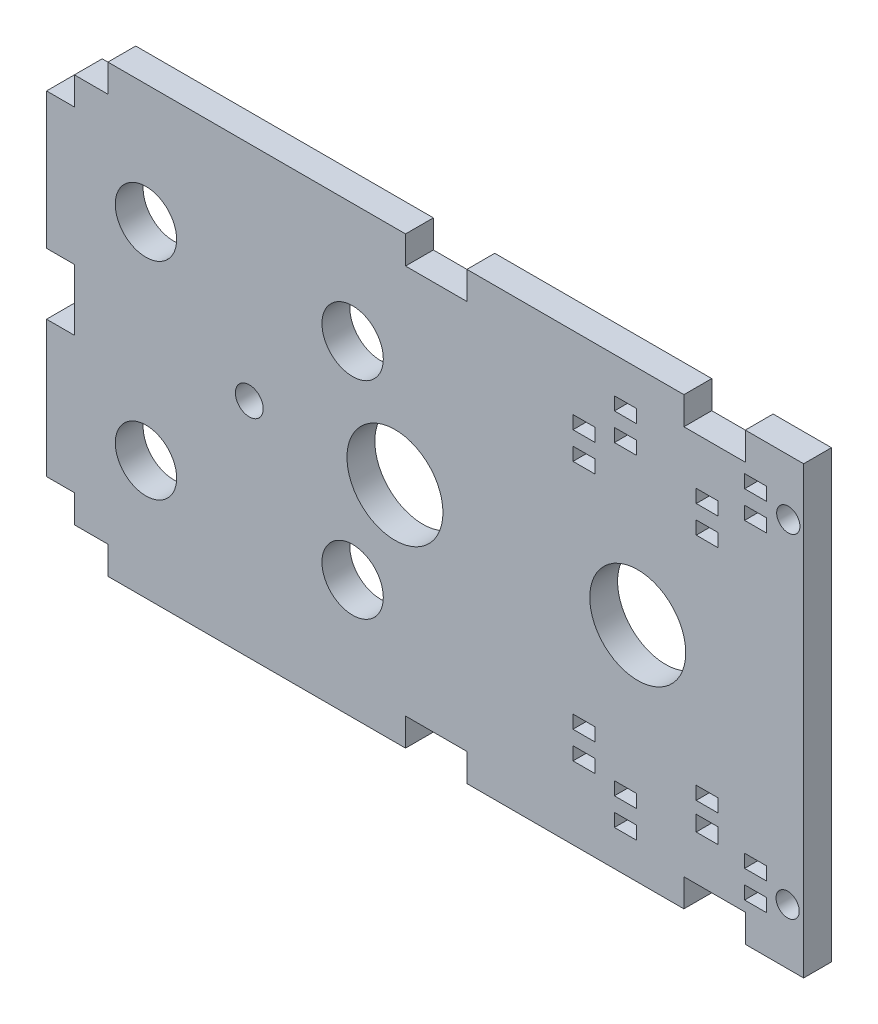
from build123d import *

# Parameters (mm, degrees)
SKETCH2_W           = 177.8
SKETCH2_H           = 101.6
BOSS_EXTRUDE3_DEPTH = 6.35
SKETCH3_R           = 10.95
SKETCH3_R_2         = 3.175
SKETCH3_R_3         = 7
CUT_EXTRUDE1_DEPTH  = 103.587389576
SKETCH7_W           = 14
SKETCH7_H           = 6.35
SKETCH7_W_2         = 6.35
SKETCH7_H_2         = 14
SKETCH7_W_3         = 5.08
SKETCH7_H_3         = 101.6
CUT_EXTRUDE2_DEPTH  = 103.587389576
SKETCH8_W           = 5
SKETCH8_H           = 3
SKETCH8_W_2         = 4.987190998
SKETCH8_R           = 2.65
CUT_EXTRUDE3_DEPTH  = 103.587389576


with BuildPart() as part:
    # Sketch2 → Boss-Extrude3 (new body)
    with BuildSketch(Plane.XY):
        Rectangle(SKETCH2_W, SKETCH2_H)
    extrude(amount=BOSS_EXTRUDE3_DEPTH)

    # Sketch3 → Cut-Extrude1 (cut, through all)
    with BuildSketch(Plane.XY.offset(6.35)):
        with Locations((-9.4120506, 0)):
            Circle(SKETCH3_R)
        with Locations((-42.64375, 0)):
            Circle(SKETCH3_R_2)
        with Locations((-66.216922318, 23.573172318)):
            Circle(SKETCH3_R_3)
        with Locations((-19.070577682, 23.573172318)):
            Circle(SKETCH3_R_3)
        with Locations((-66.216922318, -23.573172318)):
            Circle(SKETCH3_R_3)
        with Locations((-19.070577682, -23.573172318)):
            Circle(SKETCH3_R_3)
        with Locations((45.9739194, 0)):
            Circle(SKETCH3_R)
    extrude(amount=-CUT_EXTRUDE1_DEPTH, mode=Mode.SUBTRACT)

    # Sketch7 → Cut-Extrude2 (cut, through all)
    with BuildSketch(Plane.XY.offset(6.35)):
        with Locations((63.509, -47.625)):
            Rectangle(SKETCH7_W, SKETCH7_H)
        with Locations((63.509, 47.625)):
            Rectangle(SKETCH7_W, SKETCH7_H)
        with Locations((0, 47.625)):
            Rectangle(SKETCH7_W, SKETCH7_H)
        with Locations((0, -47.625)):
            Rectangle(SKETCH7_W, SKETCH7_H)
        Polygon((-82.55, -38.1), (-88.9, -38.1), (-88.9, -44.45), (-88.9, -50.8), (-74.9, -50.8), (-74.9, -44.45), (-82.55, -44.45), align=None)
        with Locations((-85.725, 0)):
            Rectangle(SKETCH7_W_2, SKETCH7_H_2)
        Polygon((-88.9, 44.45), (-88.9, 38.1), (-82.55, 38.1), (-82.55, 44.45), (-74.9, 44.45), (-74.9, 50.8), (-88.9, 50.8), align=None)
        with Locations((86.36, 0)):
            Rectangle(SKETCH7_W_3, SKETCH7_H_3)
    extrude(amount=-CUT_EXTRUDE2_DEPTH, mode=Mode.SUBTRACT)

    # Sketch8 → Cut-Extrude3 (cut, through all)
    with BuildSketch(Plane(origin=(0, 0, 0), x_dir=(-1, 0, 0), z_dir=(0, 0, -1))):
        with Locations((-61.809, -26.465)):
            Rectangle(SKETCH8_W, SKETCH8_H)
        Polygon((-59.321809002, -30.694855507), (-64.321809002, -30.694855507), (-64.309, -34.215), (-59.309, -34.215), align=None)
        with Locations((-33.689, -26.465)):
            Rectangle(SKETCH8_W, SKETCH8_H)
        with Locations((-43.143748621, -41.147)):
            Rectangle(SKETCH8_W, SKETCH8_H)
        with Locations((-43.143748621, -34.897)):
            Rectangle(SKETCH8_W, SKETCH8_H)
        with Locations((-33.695404501, -32.715)):
            Rectangle(SKETCH8_W_2, SKETCH8_H)
        with Locations((-43.143748621, 41.147)):
            Rectangle(SKETCH8_W, SKETCH8_H)
        with Locations((-43.143748621, 34.897)):
            Rectangle(SKETCH8_W, SKETCH8_H)
        with Locations((-33.701809002, 32.715)):
            Rectangle(SKETCH8_W, SKETCH8_H)
        with Locations((-33.701809002, 26.465)):
            Rectangle(SKETCH8_W, SKETCH8_H)
        with Locations((-72.850352522, 40.626855507)):
            Rectangle(SKETCH8_W, SKETCH8_H)
        with Locations((-72.850352522, 34.376855507)):
            Rectangle(SKETCH8_W, SKETCH8_H)
        with Locations((-61.821809002, 32.194855507)):
            Rectangle(SKETCH8_W, SKETCH8_H)
        with Locations((-61.821809002, 25.944855507)):
            Rectangle(SKETCH8_W, SKETCH8_H)
        with Locations((-72.850352522, -34.376855507)):
            Rectangle(SKETCH8_W, SKETCH8_H)
        with Locations((-72.850352522, -40.626855507)):
            Rectangle(SKETCH8_W, SKETCH8_H)
        with Locations((-80.320280368, 38.022017825)):
            Circle(SKETCH8_R)
        with Locations((-80.167417552, -38.111532033)):
            Circle(SKETCH8_R)
    extrude(amount=-CUT_EXTRUDE3_DEPTH, mode=Mode.SUBTRACT)


solid = part.part
